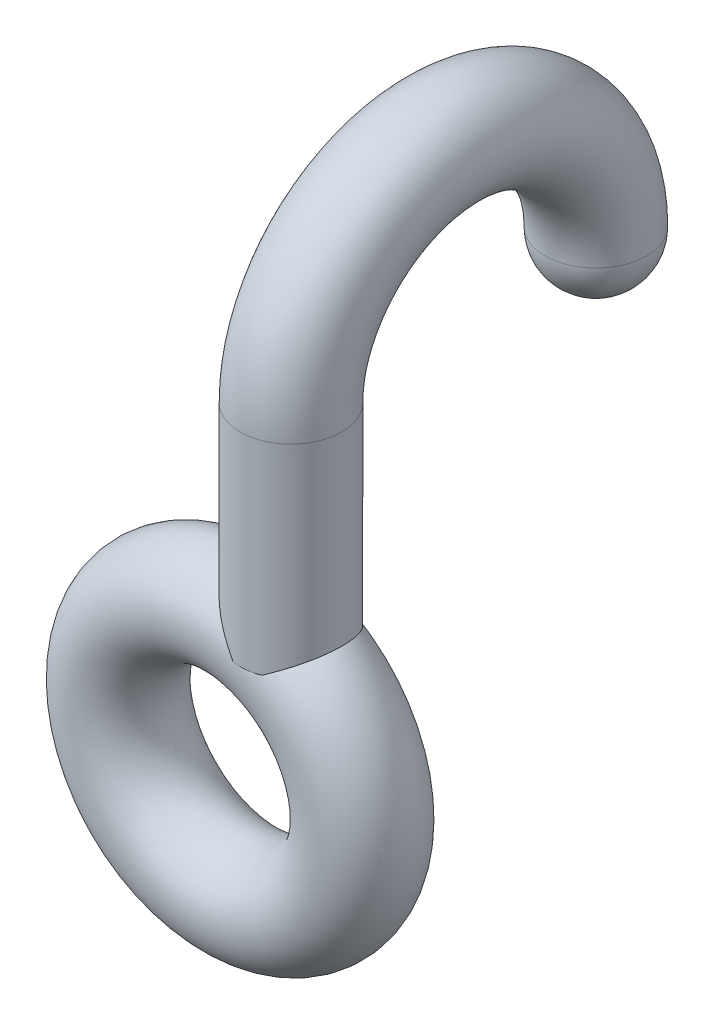
from build123d import *

# Parameters (mm, degrees)
SKETCH_1_R         = 25
SKETCH_2_R         = 25
EXTRUDE_1_DEPTH    = 100
SKETCH_3_R         = 25
REVOLVE_2_ANGLE    = 180
DOME_1_FACE_RADIUS = 25
DOME_1_HEIGHT      = 25


with BuildPart() as part:
    # 草图1 → 旋转1 (revolve)
    with BuildSketch(Plane(origin=(0, 0, 0), x_dir=(1, 0, 0), z_dir=(0, 1, 0))):
        with Locations((60, 0)):
            Circle(SKETCH_1_R)
    revolve(axis=Axis((0, 0, 1000), (0, 0, -1)))

    # 草图2 → 凸台-拉伸1 (add)
    with BuildSketch(Plane(origin=(0, 60, 0), x_dir=(1, 0, 0), z_dir=(0, 1, 0))):
        with Locations(Location((25, 0, 0), (0, 0, 98.456519335))):
            Circle(SKETCH_2_R)
    extrude(amount=EXTRUDE_1_DEPTH)

    # 草图3 → 旋转2 (revolve)
    with BuildSketch(Plane(origin=(0, 160, 0), x_dir=(1, 0, 0), z_dir=(0, 1, 0))):
        with Locations(Location((25, 0, 0), (0, 0, 98.456519335))):
            Circle(SKETCH_3_R)
    revolve(axis=Axis((-985.270554807, 160, -75), (-1, 0, 0)), revolution_arc=REVOLVE_2_ANGLE)

    # 圆顶1: a dome of height H over a round flat face of radius A is a cap of a sphere of radius (A * A + H * H) / (2 * H)
    dome_1_r = (DOME_1_FACE_RADIUS * DOME_1_FACE_RADIUS + DOME_1_HEIGHT * DOME_1_HEIGHT) / (2 * DOME_1_HEIGHT)
    dome_1_base = Plane((25, 160, -150), z_dir=(0, -1, 0))
    with Locations(dome_1_base.offset(DOME_1_HEIGHT - dome_1_r)):
        dome_1_ball = Sphere(dome_1_r, mode=Mode.PRIVATE)
    add(split(dome_1_ball, bisect_by=dome_1_base, keep=Keep.TOP, mode=Mode.PRIVATE))


solid = part.part
